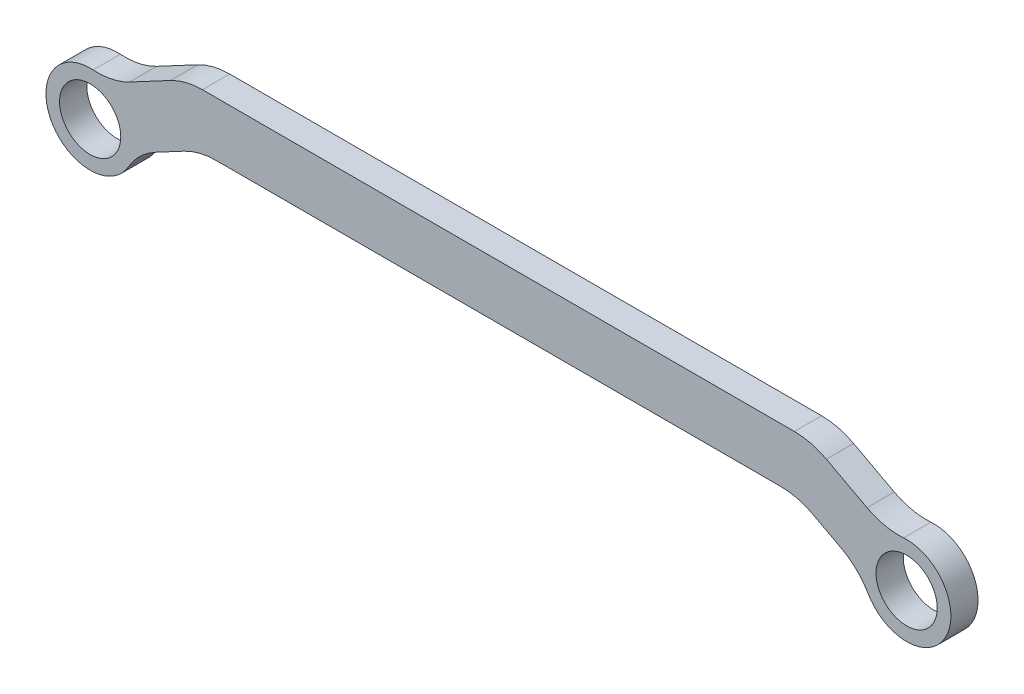
from build123d import *

# Parameters (mm, degrees)
SKETCH1_R           = 6.5
SKETCH1_R_2         = 4.5
BOSS_EXTRUDE1_DEPTH = 4
FILLET1_R           = 10


with BuildPart() as part:
    # Sketch1 → Boss-Extrude1 (new body)
    # profile 1 of 3: a face of its own
    with BuildSketch(Plane.XY):
        with BuildLine():
            ThreePointArc((6.5, 0), (6.475721286, -0.561278744), (6.403066514, -1.118364526))
            Line((6.403066514, -1.118364526), (16, 4))
            Line((16, 4), (104, 4))
            Line((104, 4), (113.596933486, -1.118364526))
            ThreePointArc((113.596933486, -1.118364526), (114.264705882, 3.058823529), (117.361639368, 5.940459004))
            Line((117.361639368, 5.940459004), (106, 12))
            Line((106, 12), (14, 12))
            Line((14, 12), (2.638360632, 5.940459004))
            ThreePointArc((2.638360632, 5.940459004), (5.449740549, 3.542644203), (6.5, 0))
        make_face()
    # profile 2 of 3: a face of its own
    with BuildSketch(Plane.XY):
        Circle(SKETCH1_R)
        Circle(SKETCH1_R_2, mode=Mode.SUBTRACT)
    # profile 3 of 3: a face of its own
    with BuildSketch(Plane.XY):
        with Locations((120, 0)):
            Circle(SKETCH1_R)
        with Locations((120, 0)):
            Circle(SKETCH1_R_2, mode=Mode.SUBTRACT)
    extrude(amount=BOSS_EXTRUDE1_DEPTH)

    # Fillet1
    fillet1_edges = [part.edges().sort_by_distance(p)[0] for p in [
        (104, 4, 2),
        (16, 4, 2),
        (6.403066514, -1.118364526, 2),
        (2.638360632, 5.940459004, 2),
        (14, 12, 2),
        (106, 12, 2),
        (117.361639368, 5.940459004, 2),
        (113.596933486, -1.118364526, 2),
    ]]
    fillet(fillet1_edges, radius=FILLET1_R)


solid = part.part
